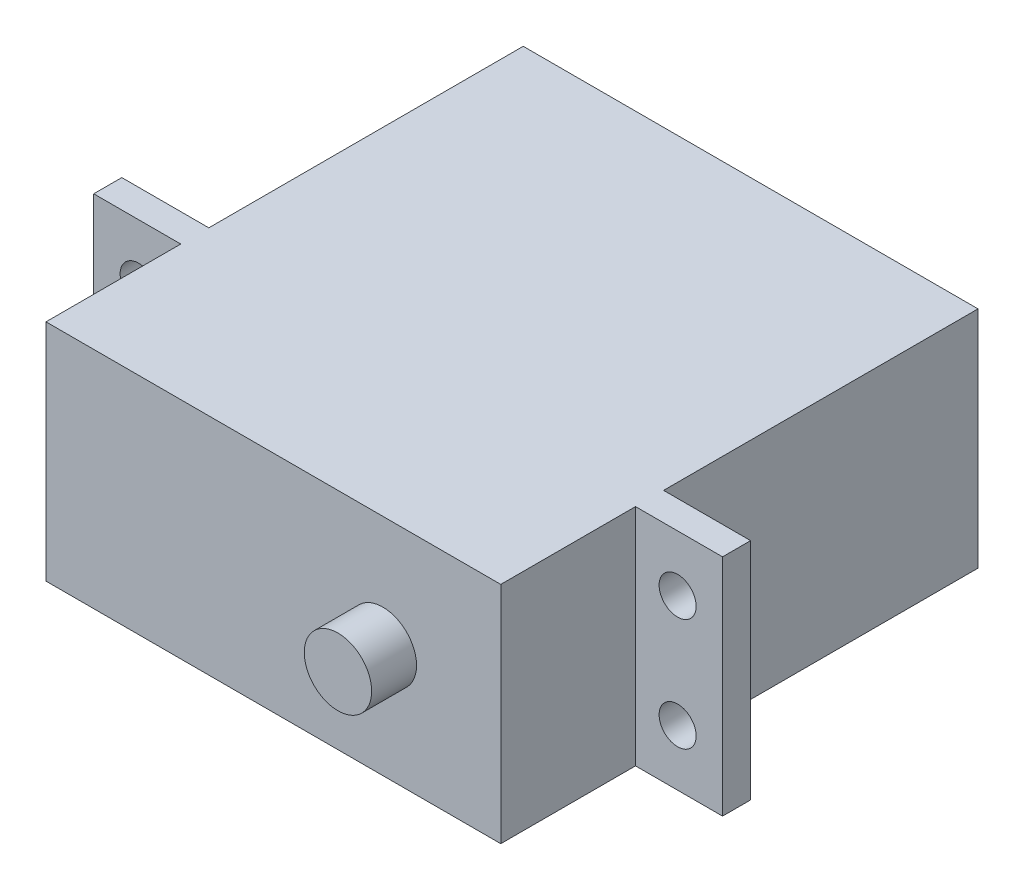
from build123d import *

# Parameters (mm, degrees)
SKETCH_1_W          = 40.5
SKETCH_1_H          = 20
EXTRUDE_1_DEPTH     = 28
SKETCH_2_W          = 7.75
SKETCH_2_H          = 20
SKETCH_2_W_2        = 40.5
EXTRUDE_2_DEPTH     = 2.5
SKETCH_3_W          = 40.5
SKETCH_3_H          = 20
EXTRUDE_3_DEPTH     = 12
SKETCH_4_R          = 3
EXTRUDE_4_DEPTH     = 4
SKETCH_5_R          = 1.65
CUT_EXTRUDE_1_DEPTH = 61.483985484


with BuildPart() as part:
    # 草图1 → 凸台-拉伸1 (new body)
    with BuildSketch(Plane.XY):
        with Locations((20.25, -10)):
            Rectangle(SKETCH_1_W, SKETCH_1_H)
    extrude(amount=EXTRUDE_1_DEPTH)

    # 草图2 → 凸台-拉伸2 (add)
    with BuildSketch(Plane.XY.offset(28)):
        with Locations((-3.875, -10)):
            Rectangle(SKETCH_2_W, SKETCH_2_H)
        with Locations((20.25, -10)):
            Rectangle(SKETCH_2_W_2, SKETCH_2_H)
        with Locations((44.375, -10)):
            Rectangle(SKETCH_2_W, SKETCH_2_H)
    extrude(amount=EXTRUDE_2_DEPTH)

    # 草图3 → 凸台-拉伸3 (add)
    with BuildSketch(Plane.XY.offset(30.5)):
        with Locations((20.25, -10)):
            Rectangle(SKETCH_3_W, SKETCH_3_H)
    extrude(amount=EXTRUDE_3_DEPTH)

    # 草图4 → 凸台-拉伸4 (add)
    with BuildSketch(Plane.XY.offset(42.5)):
        with Locations((30, -10)):
            Circle(SKETCH_4_R)
    extrude(amount=EXTRUDE_4_DEPTH)

    # 草图5 → 切除-拉伸1 (cut, through all)
    with BuildSketch(Plane.XY.offset(30.5)):
        with Locations((-3.75, -5)):
            Circle(SKETCH_5_R)
        with Locations((-3.75, -15)):
            Circle(SKETCH_5_R)
        with Locations((44.25, -5)):
            Circle(SKETCH_5_R)
        with Locations((44.25, -15)):
            Circle(SKETCH_5_R)
    extrude(amount=-CUT_EXTRUDE_1_DEPTH, mode=Mode.SUBTRACT)


solid = part.part
